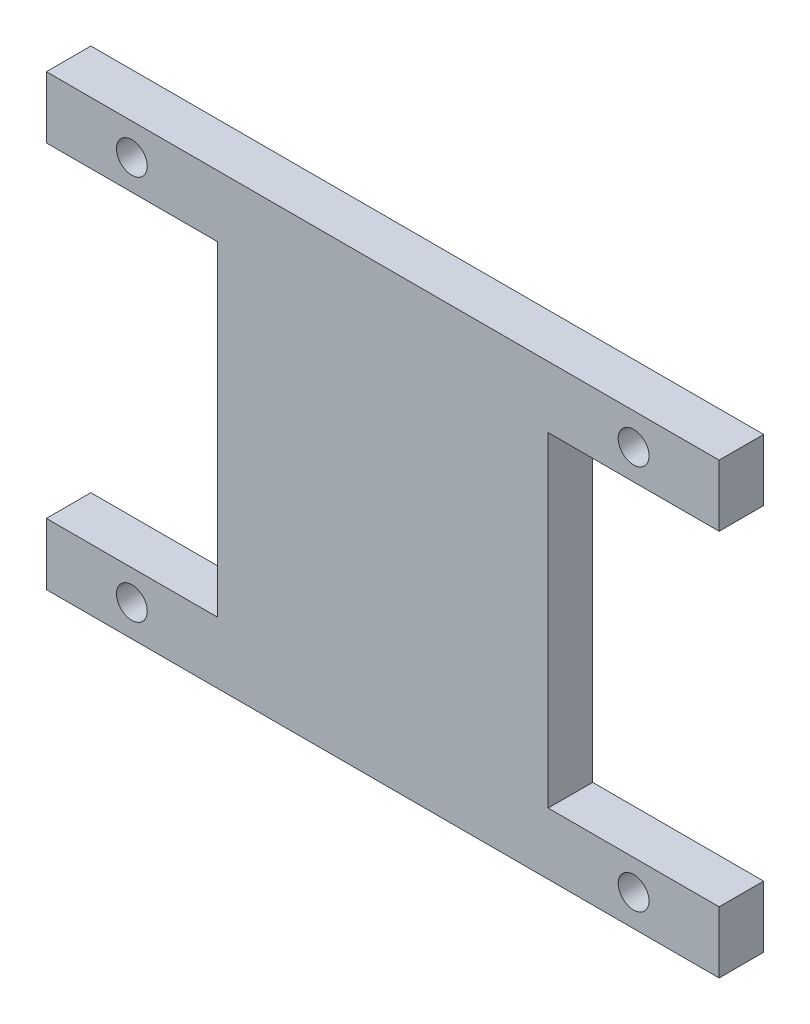
from build123d import *

# Parameters (mm, degrees)
SKETCH1_R           = 1.1
BOSS_EXTRUDE1_DEPTH = 3.175


with BuildPart() as part:
    # Sketch1 → Boss-Extrude1 (new body)
    with BuildSketch(Plane.XY):
        Polygon((0, 4.4), (0, 0), (48, 0), (48, 4.4), (35.8, 4.4), (35.8, 27.6), (48, 27.6), (48, 32), (0, 32), (0, 27.6), (12.2, 27.6), (12.2, 4.4), align=None)
        with Locations((6.1, 2.25)):
            Circle(SKETCH1_R, mode=Mode.SUBTRACT)
        with Locations((41.9, 2.25)):
            Circle(SKETCH1_R, mode=Mode.SUBTRACT)
        with Locations((6.1, 29.75)):
            Circle(SKETCH1_R, mode=Mode.SUBTRACT)
        with Locations((41.9, 29.75)):
            Circle(SKETCH1_R, mode=Mode.SUBTRACT)
    extrude(amount=BOSS_EXTRUDE1_DEPTH)


solid = part.part
